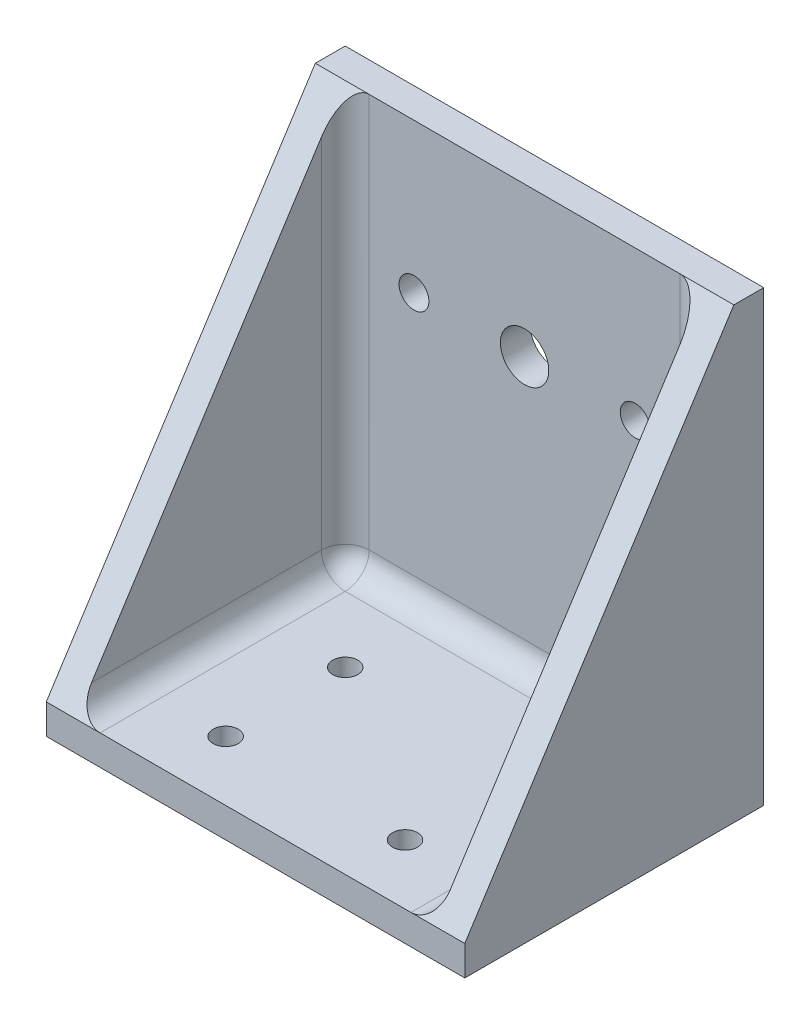
from build123d import *

# Parameters (mm, degrees)
SKETCH1_W           = 70
SKETCH1_H           = 50
BOSS_EXTRUDE1_DEPTH = 5
SKETCH2_W           = 70
SKETCH2_H           = 5
BOSS_EXTRUDE2_DEPTH = 70
SKETCH3_R           = 4.05
CUT_EXTRUDE1_DEPTH  = 10
SKETCH4_R           = 2.5
CUT_EXTRUDE2_DEPTH  = 10
BOSS_EXTRUDE3_DEPTH = 5
BOSS_EXTRUDE4_DEPTH = 5
FILLET1_R           = 4
SKETCH7_R           = 2.1
CUT_EXTRUDE3_DEPTH  = 5


with BuildPart() as part:
    # Sketch1 → Boss-Extrude1 (new body)
    with BuildSketch(Plane(origin=(0, 0, 0), x_dir=(1, 0, 0), z_dir=(0, 1, 0))):
        Rectangle(SKETCH1_W, SKETCH1_H)
    extrude(amount=BOSS_EXTRUDE1_DEPTH)

    # Sketch2 → Boss-Extrude2 (add)
    with BuildSketch(Plane(origin=(0, 5, 0), x_dir=(1, 0, 0), z_dir=(0, 1, 0))):
        with Locations((0, 22.5)):
            Rectangle(SKETCH2_W, SKETCH2_H)
    extrude(amount=BOSS_EXTRUDE2_DEPTH)

    # Sketch3 → Cut-Extrude1 (cut)
    with BuildSketch(Plane(origin=(0, 0, -25), x_dir=(-1, 0, 0), z_dir=(0, 0, -1))):
        with Locations((0, 50)):
            Circle(SKETCH3_R)
    extrude(amount=-CUT_EXTRUDE1_DEPTH, mode=Mode.SUBTRACT)

    # Sketch4 → Cut-Extrude2 (cut)
    with BuildSketch(Plane(origin=(0, 0, -25), x_dir=(-1, 0, 0), z_dir=(0, 0, -1))):
        with Locations((-18.5, 50)):
            Circle(SKETCH4_R)
        with Locations((18.5, 50)):
            Circle(SKETCH4_R)
    extrude(amount=-CUT_EXTRUDE2_DEPTH, mode=Mode.SUBTRACT)

    # Sketch5 → Boss-Extrude3 (add)
    with BuildSketch(Plane(origin=(35, 0, 0), x_dir=(0, 0, -1), z_dir=(1, 0, 0))):
        Polygon((20, 75), (-25, 5), (20, 5), align=None)
    extrude(amount=-BOSS_EXTRUDE3_DEPTH)

    # Sketch6 → Boss-Extrude4 (add)
    with BuildSketch(Plane.ZY.offset(35)):
        Polygon((-20, 75), (25, 5), (-20, 5), align=None)
    extrude(amount=-BOSS_EXTRUDE4_DEPTH)

    # Fillet1
    fillet1_edges = [part.edges().sort_by_distance(p)[0] for p in [
        (30, 40, -20),
        (30, 5, 2.5),
        (0, 5, -20),
        (-30, 40, -20),
        (-30, 5, 2.5),
    ]]
    fillet(fillet1_edges, radius=FILLET1_R)

    # Sketch7 → Cut-Extrude3 (cut)
    with BuildSketch(Plane(origin=(0, 5, 0), x_dir=(1, 0, 0), z_dir=(0, 1, 0))):
        with Locations(Location((-15, 5, 0), (0, 0, 270))):
            Circle(SKETCH7_R)
        with Locations(Location((15, 5, 0), (0, 0, 270))):
            Circle(SKETCH7_R)
        with Locations(Location((15, -15, 0), (0, 0, 270))):
            Circle(SKETCH7_R)
        with Locations(Location((-15, -15, 0), (0, 0, 270))):
            Circle(SKETCH7_R)
    extrude(amount=-CUT_EXTRUDE3_DEPTH, mode=Mode.SUBTRACT)


solid = part.part
